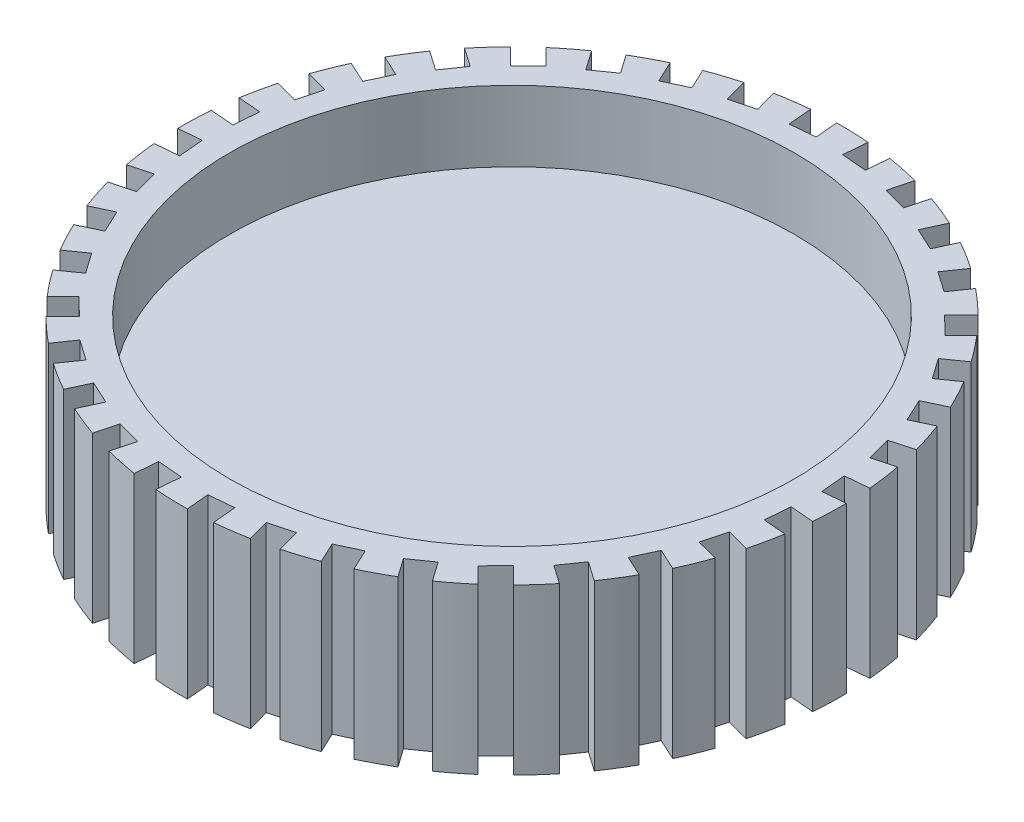
from build123d import *

# Parameters (mm, degrees)
SKETCH_1_R          = 13
EXTRUDE_1_DEPTH     = 7
SKETCH_6_R          = 14
EXTRUDE_4_DEPTH     = 7
SKETCH_2_R          = 12
CUT_EXTRUDE_1_DEPTH = 3
CUT_EXTRUDE_2_DEPTH = 22


with BuildPart() as part:
    # 草图1 → 凸台-拉伸1 (new body)
    with BuildSketch(Plane(origin=(0, 0, 0), x_dir=(1, 0, 0), z_dir=(0, 1, 0))):
        with Locations(Location((0, 0, 0), (0, 0, 270))):
            Circle(SKETCH_1_R)
    extrude(amount=EXTRUDE_1_DEPTH)

    # 草图6 → 凸台-拉伸4 (add, through all)
    with BuildSketch(Plane(origin=(0, 7, 0), x_dir=(1, 0, 0), z_dir=(0, 1, 0))):
        with Locations(Location((0, 0, 0), (0, 0, 270))):
            Circle(SKETCH_6_R)
    extrude(amount=-EXTRUDE_4_DEPTH)

    # 草图2 → 切除-拉伸1 (cut)
    with BuildSketch(Plane(origin=(0, 7, 0), x_dir=(1, 0, 0), z_dir=(0, 1, 0))):
        with Locations(Location((0, 0, 0), (0, 0, 270))):
            Circle(SKETCH_2_R)
    extrude(amount=-CUT_EXTRUDE_1_DEPTH, mode=Mode.SUBTRACT)

    # 草图7 → 切除-拉伸2 (cut, through all)
    with BuildSketch(Plane(origin=(0, 7, 0), x_dir=(1, 0, 0), z_dir=(0, 1, 0))):
        Polygon((-15.646830527, 4.142221687), (-12.567085782, 3.326913727), (-12.296421758, 4.349320163), (-15.376166503, 5.164628122), align=None)
        Polygon((-14.689830765, 6.79633564), (-11.798451005, 5.458621977), (-11.354359961, 6.418495447), (-14.245739722, 7.756209109), align=None)
        Polygon((-13.28648793, 9.243946373), (-10.671326264, 7.42447276), (-10.067301683, 8.292647994), (-12.682463348, 10.112121607), align=None)
        Polygon((-11.479441881, 11.410684473), (-9.219958675, 9.164734695), (-8.474353537, 9.914832629), (-10.733836743, 12.160782407), align=None)
        Polygon((-9.3235988, 13.230714699), (-7.488447307, 10.626530804), (-6.623916447, 11.235760092), (-8.45906794, 13.839943987), align=None)
        Polygon((-6.884462888, 14.648736355), (-5.529403257, 11.765445152), (-4.572215008, 12.215294669), (-5.927274639, 15.098585872), align=None)
        Polygon((-4.236146054, 15.621663569), (-3.402351087, 12.546872402), (-2.381589129, 12.8236737), (-3.215384096, 15.898464866), align=None)
        Polygon((-1.459116066, 16.11993444), (-1.171920201, 12.947069284), (-0.11859987, 13.042411894), (-0.405795735, 16.21527705), align=None)
        Polygon((1.362248425, 16.12840926), (1.094118888, 12.953876017), (2.147992986, 12.864863002), (2.416122524, 16.039396246), align=None)
        Polygon((4.142221687, 15.646830527), (3.326913727, 12.567085782), (4.349320163, 12.296421758), (5.164628122, 15.376166503), align=None)
        Polygon((6.79633564, 14.689830765), (5.458621977, 11.798451005), (6.418495447, 11.354359961), (7.756209109, 14.245739722), align=None)
        Polygon((9.243946373, 13.28648793), (7.42447276, 10.671326264), (8.292647994, 10.067301683), (10.112121607, 12.682463348), align=None)
        Polygon((11.410684473, 11.479441881), (9.164734695, 9.219958675), (9.914832629, 8.474353537), (12.160782407, 10.733836743), align=None)
        Polygon((13.230714699, 9.3235988), (10.626530804, 7.488447307), (11.235760092, 6.623916447), (13.839943987, 8.45906794), align=None)
        Polygon((14.648736355, 6.884462888), (11.765445152, 5.529403257), (12.215294669, 4.572215008), (15.098585872, 5.927274639), align=None)
        Polygon((15.621663569, 4.236146054), (12.546872402, 3.402351087), (12.8236737, 2.381589129), (15.898464866, 3.215384096), align=None)
        Polygon((16.11993444, 1.459116066), (12.947069284, 1.171920201), (13.042411894, 0.11859987), (16.21527705, 0.405795735), align=None)
        Polygon((16.12840926, -1.362248425), (12.953876017, -1.094118888), (12.864863002, -2.147992986), (16.039396246, -2.416122524), align=None)
        Polygon((15.646830527, -4.142221687), (12.567085782, -3.326913727), (12.296421758, -4.349320163), (15.376166503, -5.164628122), align=None)
        Polygon((14.689830765, -6.79633564), (11.798451005, -5.458621977), (11.354359961, -6.418495447), (14.245739722, -7.756209109), align=None)
        Polygon((13.28648793, -9.243946373), (10.671326264, -7.42447276), (10.067301683, -8.292647994), (12.682463348, -10.112121607), align=None)
        Polygon((11.479441881, -11.410684473), (9.219958675, -9.164734695), (8.474353537, -9.914832629), (10.733836743, -12.160782407), align=None)
        Polygon((9.3235988, -13.230714699), (7.488447307, -10.626530804), (6.623916447, -11.235760092), (8.45906794, -13.839943987), align=None)
        Polygon((6.884462888, -14.648736355), (5.529403257, -11.765445152), (4.572215008, -12.215294669), (5.927274639, -15.098585872), align=None)
        Polygon((4.236146054, -15.621663569), (3.402351087, -12.546872402), (2.381589129, -12.8236737), (3.215384096, -15.898464866), align=None)
        Polygon((1.459116066, -16.11993444), (1.171920201, -12.947069284), (0.11859987, -13.042411894), (0.405795735, -16.21527705), align=None)
        Polygon((-1.362248425, -16.12840926), (-1.094118888, -12.953876017), (-2.147992986, -12.864863002), (-2.416122524, -16.039396246), align=None)
        Polygon((-4.142221687, -15.646830527), (-3.326913727, -12.567085782), (-4.349320163, -12.296421758), (-5.164628122, -15.376166503), align=None)
        Polygon((-6.79633564, -14.689830765), (-5.458621977, -11.798451005), (-6.418495447, -11.354359961), (-7.756209109, -14.245739722), align=None)
        Polygon((-9.243946373, -13.28648793), (-7.42447276, -10.671326264), (-8.292647994, -10.067301683), (-10.112121607, -12.682463348), align=None)
        Polygon((-11.410684473, -11.479441881), (-9.164734695, -9.219958675), (-9.914832629, -8.474353537), (-12.160782407, -10.733836743), align=None)
        Polygon((-13.230714699, -9.3235988), (-10.626530804, -7.488447307), (-11.235760092, -6.623916447), (-13.839943987, -8.45906794), align=None)
        Polygon((-14.648736355, -6.884462888), (-11.765445152, -5.529403257), (-12.215294669, -4.572215008), (-15.098585872, -5.927274639), align=None)
        Polygon((-15.621663569, -4.236146054), (-12.546872402, -3.402351087), (-12.8236737, -2.381589129), (-15.898464866, -3.215384096), align=None)
        Polygon((-16.11993444, -1.459116066), (-12.947069284, -1.171920201), (-13.042411894, -0.11859987), (-16.21527705, -0.405795735), align=None)
        Polygon((-16.12840926, 1.362248425), (-12.953876017, 1.094118888), (-12.864863002, 2.147992986), (-16.039396246, 2.416122524), align=None)
    extrude(amount=-CUT_EXTRUDE_2_DEPTH, mode=Mode.SUBTRACT)


solid = part.part
